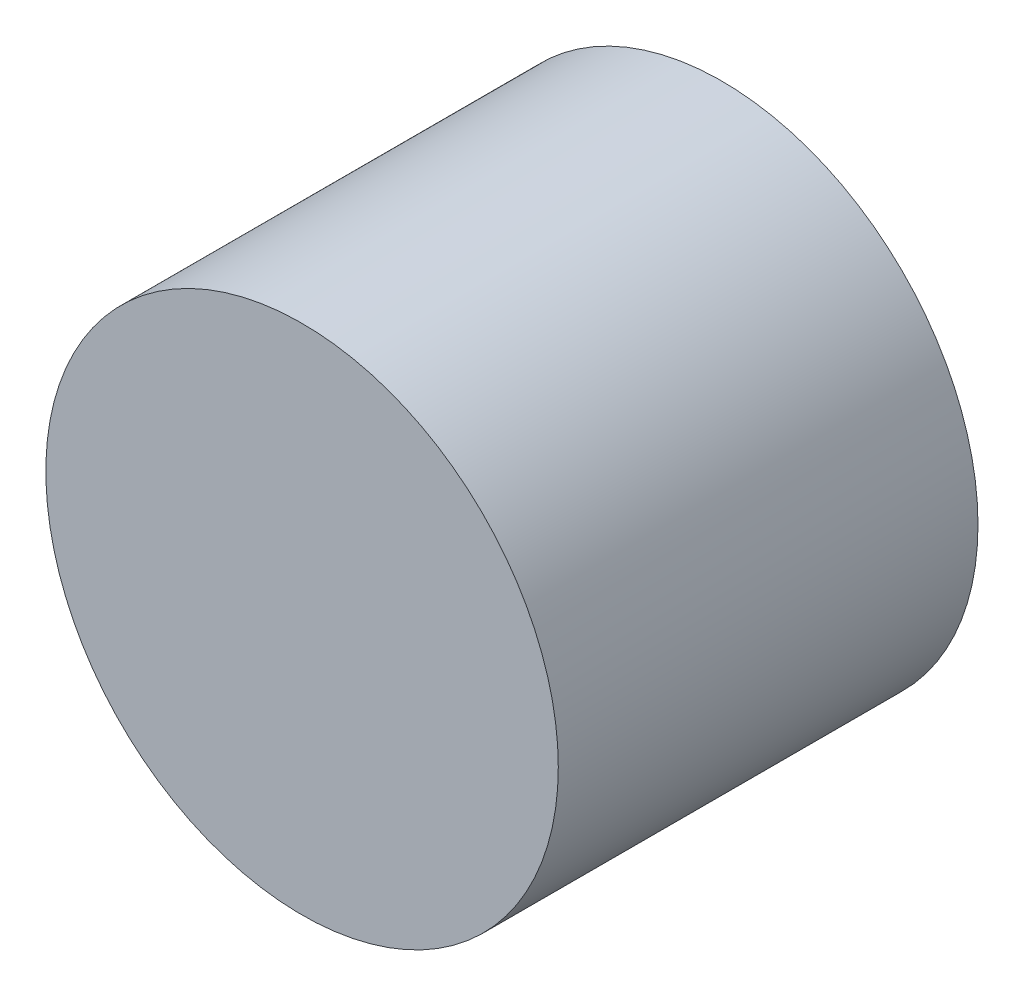
from build123d import *

# Parameters (mm, degrees)
SKETCH1_R           = 8.80613
BOSS_EXTRUDE1_DEPTH = 14.42408


with BuildPart() as part:
    # Sketch1 → Boss-Extrude1 (new body)
    with BuildSketch(Plane.XY):
        with Locations((6.787, -3.953)):
            Circle(SKETCH1_R)
    extrude(amount=BOSS_EXTRUDE1_DEPTH)


solid = part.part
